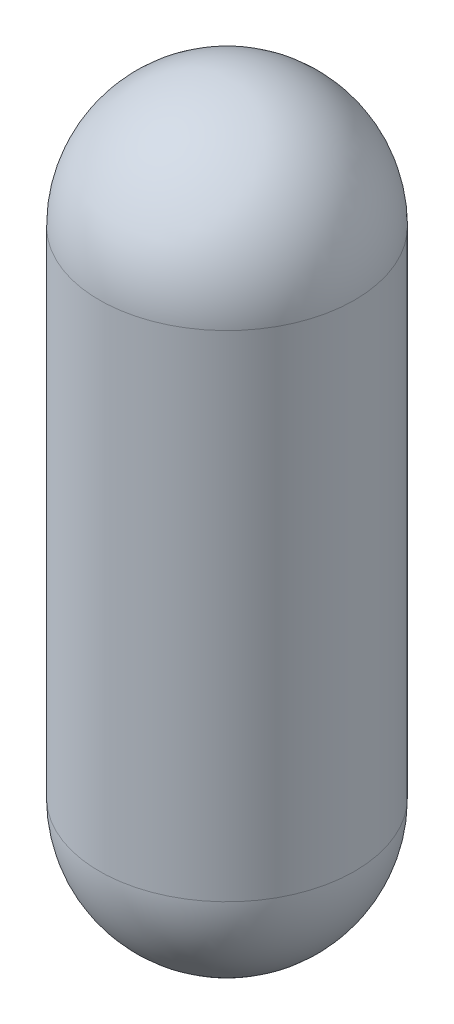
from build123d import *


with BuildPart() as part:
    # Sketch1 → Revolve1 (revolve)
    with BuildSketch(Plane.XY):
        with BuildLine():
            Line((-163.83, -317.5), (-163.83, 317.5))
            ThreePointArc((-163.83, 317.5), (-115.845303962, 433.345303962), (0, 481.33))
            Line((0, 481.33), (0, -481.33))
            ThreePointArc((0, -481.33), (-115.845303962, -433.345303962), (-163.83, -317.5))
        make_face()
    revolve(axis=Axis((0, 481.33, 0), (0, -1, 0)))


solid = part.part
